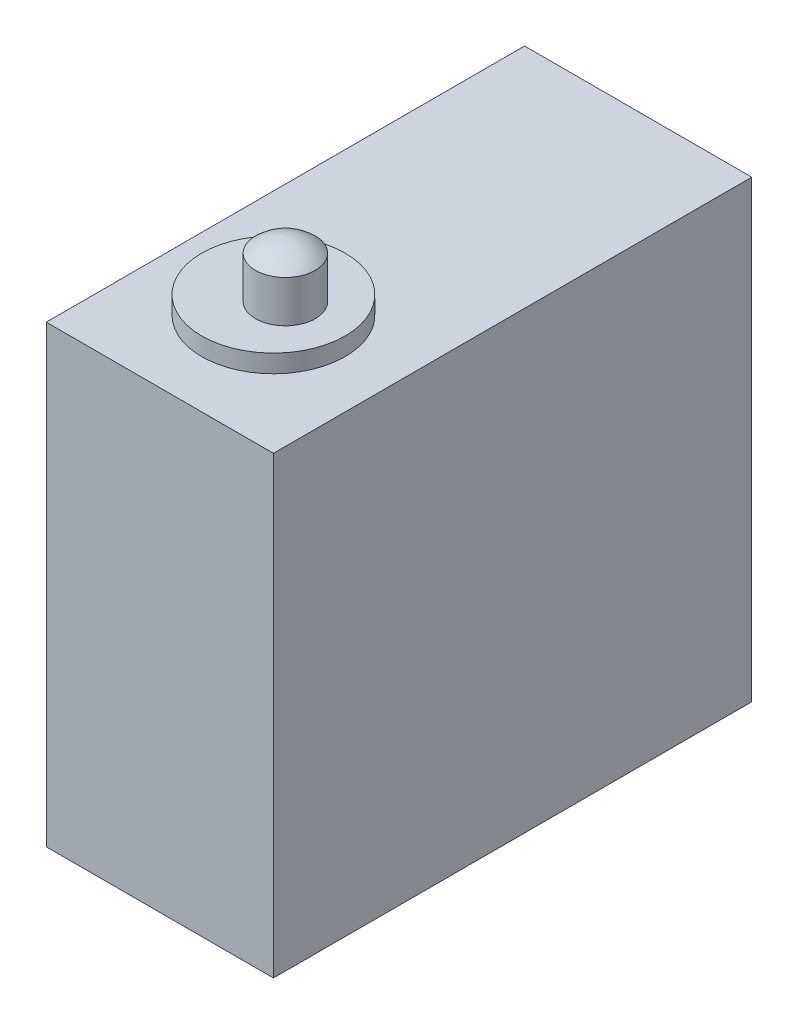
from build123d import *

# Parameters (mm, degrees)
ESQUISSE1_W       = 40
ESQUISSE1_H       = 38
EXTRUSION1_DEPTH  = 19
ESQUISSE2_R       = 6
EXTRUSION2_DEPTH  = 1.5
ESQUISSE3_R       = 2.5
EXTRUSION3_DEPTH  = 3.5
D_ME1_FACE_RADIUS = 2.5
D_ME1_HEIGHT      = 1


with BuildPart() as part:
    # Esquisse1 → Extrusion1 (new body)
    with BuildSketch(Plane(origin=(0, 0, 0), x_dir=(0, 0, -1), z_dir=(1, 0, 0))):
        with Locations((-4.8337322, -1.663178935)):
            Rectangle(ESQUISSE1_W, ESQUISSE1_H)
    extrude(amount=EXTRUSION1_DEPTH)

    # Esquisse2 → Extrusion2 (add)
    with BuildSketch(Plane(origin=(0, 17.336821065, 0), x_dir=(1, 0, 0), z_dir=(0, 1, 0))):
        with Locations(Location((9, -14.8337322, 0), (0, 0, 90))):
            Circle(ESQUISSE2_R)
    extrude(amount=EXTRUSION2_DEPTH)

    # Esquisse3 → Extrusion3 (add)
    with BuildSketch(Plane(origin=(0, 18.836821065, 0), x_dir=(-1, 0, 0), z_dir=(0, 1, 0))):
        with Locations(Location((-10, 14.8337322, 0), (0, 0, 90))):
            Circle(ESQUISSE3_R)
    extrude(amount=EXTRUSION3_DEPTH)

    # Dôme1: a dome of height H over a round flat face of radius A is a cap of a sphere of radius (A * A + H * H) / (2 * H)
    d_me1_r = (D_ME1_FACE_RADIUS * D_ME1_FACE_RADIUS + D_ME1_HEIGHT * D_ME1_HEIGHT) / (2 * D_ME1_HEIGHT)
    d_me1_base = Plane((10, 22.336821065, 14.8337322), z_dir=(0, 1, 0))
    with Locations(d_me1_base.offset(D_ME1_HEIGHT - d_me1_r)):
        d_me1_ball = Sphere(d_me1_r, mode=Mode.PRIVATE)
    add(split(d_me1_ball, bisect_by=d_me1_base, keep=Keep.TOP, mode=Mode.PRIVATE))


solid = part.part
